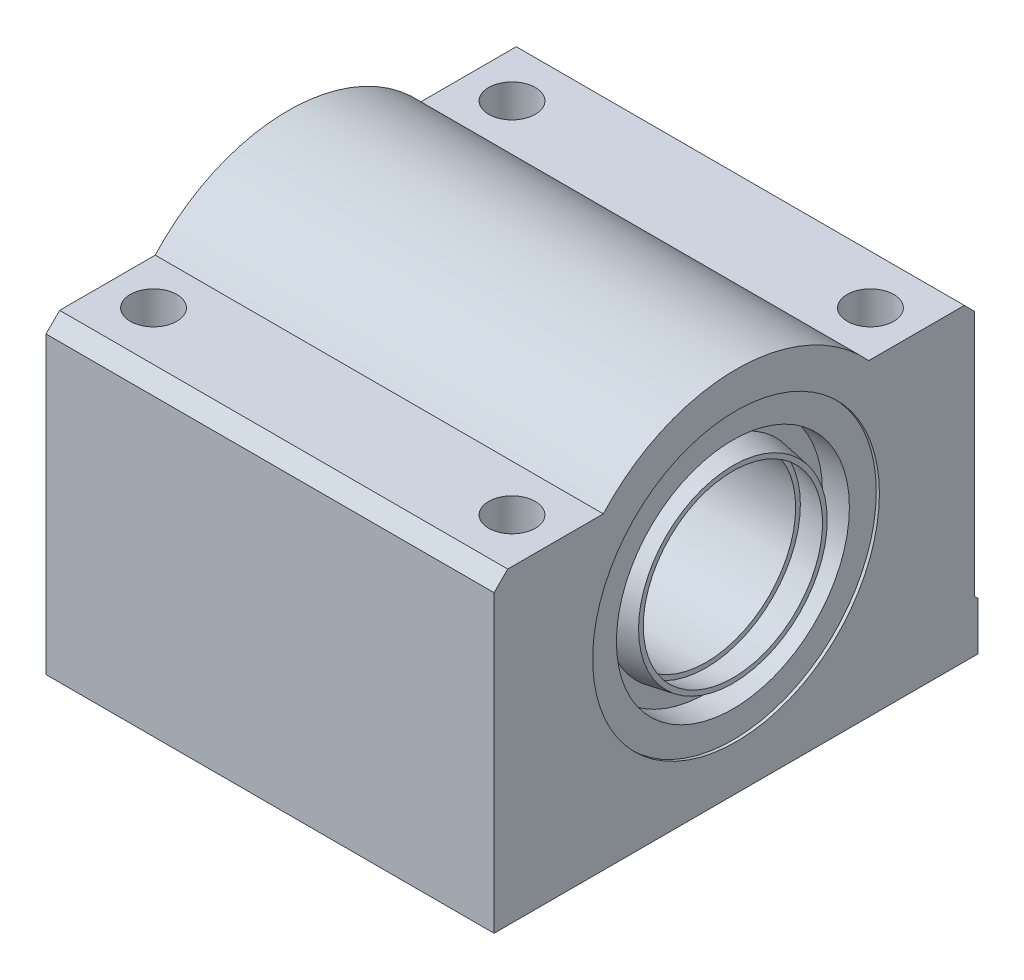
from build123d import *

# Parameters (mm, degrees)
BOSS_EXTRUDE1_DEPTH      = 25
BOSS_EXTRUDE1_DEPTH_BACK = 25
SKETCH3_R                = 10
SKETCH4_R                = 16
CUT_EXTRUDE1_DEPTH       = 3.35
BOSS_EXTRUDE2_START      = 3
SKETCH5_R                = 16
SKETCH5_R_2              = 13
BOSS_EXTRUDE2_DEPTH      = 3
CHAMFER1_SIZE            = 1.523622135
CUT_EXTRUDE2_DEPTH       = 71.071392165
SKETCH11_R               = 2.6
CUT_EXTRUDE6_DEPTH       = 17.22
SKETCH12_R               = 2.6
CUT_EXTRUDE7_DEPTH       = 56.090834083


with BuildPart() as part:
    # Sketch3 → Boss-Extrude1 (new, two sides: drawn at the far end of the back side and taken through both)
    with BuildSketch(Plane(origin=(0, 0, 0), x_dir=(0, 0, -1), z_dir=(1, 0, 0)).offset(-BOSS_EXTRUDE1_DEPTH_BACK)):
        with BuildLine():
            Line((27, 0), (27, 34.44))
            Line((27, 34.44), (14.811022922, 34.44))
            ThreePointArc((14.811022922, 34.44), (0, 41), (-14.811022922, 34.44))
            Line((-14.811022922, 34.44), (-27, 34.44))
            Line((-27, 34.44), (-27, 0))
            Line((-27, 0), (27, 0))
        make_face()
        with Locations((0, 21)):
            Circle(SKETCH3_R, mode=Mode.SUBTRACT)
    extrude(amount=BOSS_EXTRUDE1_DEPTH + BOSS_EXTRUDE1_DEPTH_BACK)

    # Sketch4 → Cut-Extrude1 (cut)
    with BuildSketch(Plane(origin=(25, 0, 0), x_dir=(0, 0, -1), z_dir=(1, 0, 0))):
        with Locations((0, 21)):
            Circle(SKETCH4_R)
    cut_extrude1 = extrude(amount=-CUT_EXTRUDE1_DEPTH, mode=Mode.SUBTRACT)

    # Sketch5 → Boss-Extrude2 (add)
    with BuildSketch(Plane(origin=(21.65, 0, 0), x_dir=(0, 0, -1), z_dir=(1, 0, 0)).offset(BOSS_EXTRUDE2_START)):
        with Locations((0, 21)):
            Circle(SKETCH5_R)
        with Locations((0, 21)):
            Circle(SKETCH5_R_2, mode=Mode.SUBTRACT)
    boss_extrude2 = extrude(amount=-BOSS_EXTRUDE2_DEPTH)

    # Sketch6 → Revolve1 (revolve)
    with BuildSketch(Plane.XY, mode=Mode.PRIVATE) as revolve1_sk:
        Polygon((24.65, 31), (24.65, 31.528980942), (21.65, 32.057961884), (21.65, 31.528980942), align=None)
    revolve1 = revolve(revolve1_sk.sketch.rotate(Axis((-24.65, 21, 0), (1, 0, 0)), 90), axis=Axis((-24.65, 21, 0), (1, 0, 0)))

    # Mirror1: Cut-Extrude1, Boss-Extrude2, Revolve1 across plane
    add(cut_extrude1.mirror(Plane(origin=(0, 0, 0), x_dir=(0, 0, 1), z_dir=(1, 0, 0))), mode=Mode.SUBTRACT)
    add(boss_extrude2.mirror(Plane(origin=(0, 0, 0), x_dir=(0, 0, 1), z_dir=(1, 0, 0))))
    add(revolve1.mirror(Plane(origin=(0, 0, 0), x_dir=(0, 0, 1), z_dir=(1, 0, 0))))

    # Chamfer1
    chamfer1_edges = [part.edges().sort_by_distance(p)[0] for p in [
        (0, 34.44, 27),
        (0, 34.44, -27),
    ]]
    chamfer(chamfer1_edges, length=CHAMFER1_SIZE)

    # Sketch7 → Cut-Extrude2 (cut, through all)
    with BuildSketch(Plane(origin=(25, 0, 0), x_dir=(0, 0, -1), z_dir=(1, 0, 0))):
        Polygon((26.619094466, 5.75), (27, 5.369094466), (27, 32.916377865), (26.619094466, 33.297283399), align=None)
    extrude(amount=-CUT_EXTRUDE2_DEPTH, mode=Mode.SUBTRACT)

    # Sketch11 → Cut-Extrude6 (cut)
    with BuildSketch(Plane.XZ):
        with Locations(Location((-20, 20, 0), (0, 0, 270))):
            Circle(SKETCH11_R)
        with Locations(Location((20, 20, 0), (0, 0, 270))):
            Circle(SKETCH11_R)
        with Locations(Location((20, -20, 0), (0, 0, 270))):
            Circle(SKETCH11_R)
        with Locations(Location((-20, -20, 0), (0, 0, 270))):
            Circle(SKETCH11_R)
    extrude(amount=-CUT_EXTRUDE6_DEPTH, mode=Mode.SUBTRACT)

    # Sketch12 → Cut-Extrude7 (cut, through all)
    with BuildSketch(Plane.XZ):
        with Locations(Location((-20, 20, 0), (0, 0, 270))):
            Circle(SKETCH12_R)
        with Locations(Location((20, 20, 0), (0, 0, 270))):
            Circle(SKETCH12_R)
        with Locations(Location((20, -20, 0), (0, 0, 270))):
            Circle(SKETCH12_R)
        with Locations(Location((-20, -20, 0), (0, 0, 270))):
            Circle(SKETCH12_R)
    extrude(amount=-CUT_EXTRUDE7_DEPTH, mode=Mode.SUBTRACT)


solid = part.part
